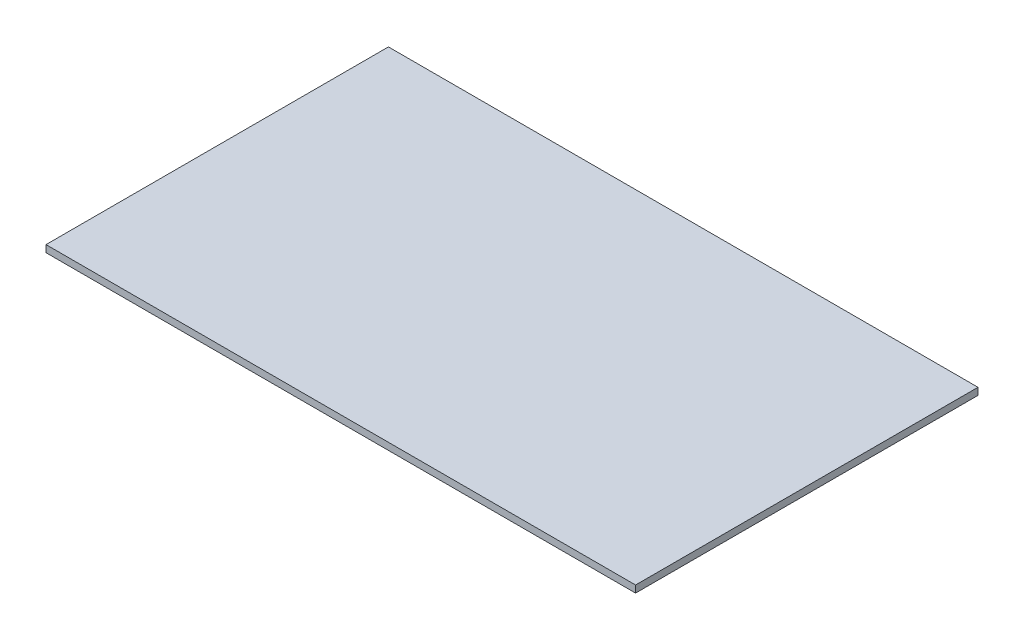
from build123d import *

# Parameters (mm, degrees)
SKETCH1_W           = 50.292
SKETCH1_H           = 29.21
BOSS_EXTRUDE1_DEPTH = 0.6


with BuildPart() as part:
    # Sketch1 → Boss-Extrude1 (new body)
    with BuildSketch(Plane(origin=(0, 0, 0), x_dir=(1, 0, 0), z_dir=(0, 1, 0))):
        with Locations((25.146, 14.605)):
            Rectangle(SKETCH1_W, SKETCH1_H)
    extrude(amount=BOSS_EXTRUDE1_DEPTH)


solid = part.part
